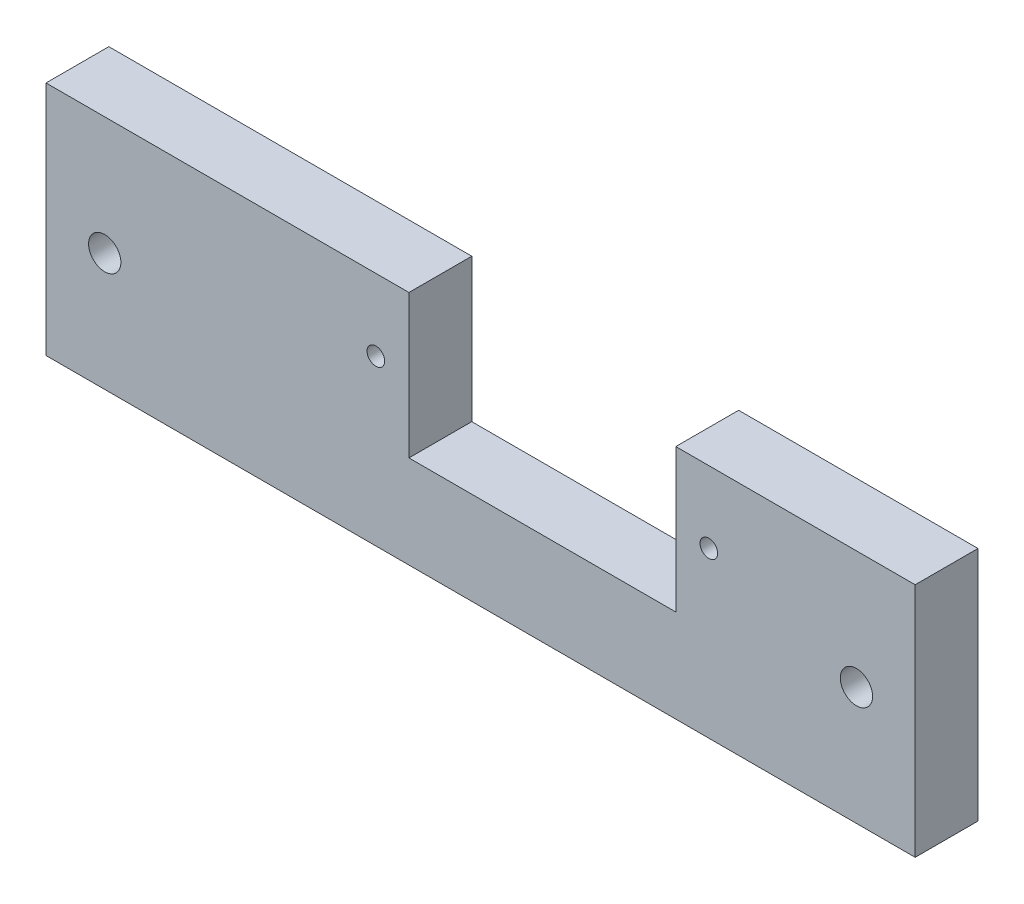
from build123d import *

# Parameters (mm, degrees)
MODEL_R             = 0.75
MODEL_R_2           = 1.375
BOSS_EXTRUDE1_DEPTH = 5.35


with BuildPart() as part:
    # Model → Boss-Extrude1 (new body)
    with BuildSketch(Plane.XY):
        Polygon((53.620001301, 20.099999383), (74.000000954, 20.099999383), (74.000000954, 0), (0, 0), (0, 20.099999383), (30.900000594, 20.099999383), (30.900000594, 7.899999618), (53.620001301, 7.899999618), align=None)
        with Locations((28.086325314, 13.999999691)):
            Circle(MODEL_R, mode=Mode.SUBTRACT)
        with Locations((56.43367564, 13.999999691)):
            Circle(MODEL_R, mode=Mode.SUBTRACT)
        with Locations((5.000000477, 10.049999692)):
            Circle(MODEL_R_2, mode=Mode.SUBTRACT)
        with Locations((69.000000477, 10.049999692)):
            Circle(MODEL_R_2, mode=Mode.SUBTRACT)
    extrude(amount=BOSS_EXTRUDE1_DEPTH)


solid = part.part
